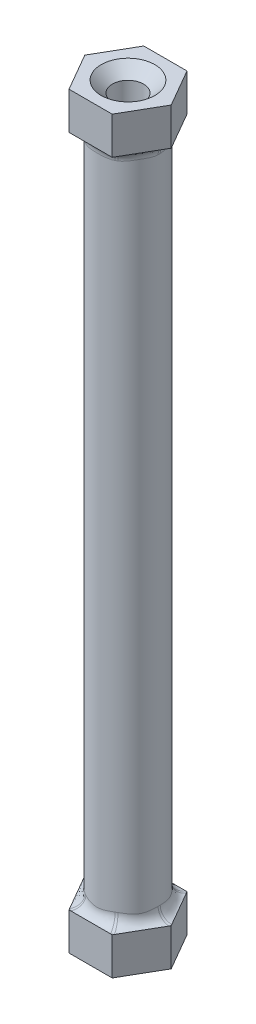
from build123d import *

# Parameters (mm, degrees)
EXTRUDE_1_DEPTH        = 3
SKETCH_2_R             = 2.5
EXTRUDE_2_DEPTH        = 54
EXTRUDE_3_DEPTH        = 3
FILLET_1_R             = 0.9
HOLE_WIZARD_M3_1_D     = 2.5
HOLE_WIZARD_M3_1_DEPTH = 9.5
HOLE_WIZARD_M3_1_TIP   = 0.751075774
HOLE_WIZARD_M3_2_D     = 2.5
HOLE_WIZARD_M3_2_DEPTH = 9.5
HOLE_WIZARD_M3_2_TIP   = 0.751075774
CHAMFER_1_SIZE         = 0.9


with BuildPart() as part:
    # 草图1 → 凸台-拉伸1 (new body)
    with BuildSketch(Plane(origin=(0, 0, 0), x_dir=(1, 0, 0), z_dir=(0, 1, 0))):
        Polygon((1.732050808, -3), (3.464101615, 0), (1.732050808, 3), (-1.732050808, 3), (-3.464101615, 0), (-1.732050808, -3), align=None)
    extrude(amount=EXTRUDE_1_DEPTH)

    # 草图2 → 凸台-拉伸2 (add)
    with BuildSketch(Plane(origin=(0, 3, 0), x_dir=(1, 0, 0), z_dir=(0, 1, 0))):
        with Locations(Location((0, 0, 0), (0, 0, 270))):
            Circle(SKETCH_2_R)
    extrude(amount=EXTRUDE_2_DEPTH)

    # 草图3 → 凸台-拉伸3 (add)
    with BuildSketch(Plane(origin=(0, 57, 0), x_dir=(1, 0, 0), z_dir=(0, 1, 0))):
        Polygon((-1.732050808, -3), (1.732050808, -3), (3.464101615, 0), (1.732050808, 3), (-1.732050808, 3), (-3.464101615, 0), align=None)
    extrude(amount=EXTRUDE_3_DEPTH)

    # 圆角1
    fillet_1_edges = [part.edges().sort_by_distance(p)[0] for p in [
        (0, 3, -2.5),
        (0, 57, -2.5),
    ]]
    fillet(fillet_1_edges, radius=FILLET_1_R)

    # M3 螺纹孔1
    with Locations(Plane(origin=(0, 60, 0), x_dir=(1, 0, 0), z_dir=(0, 1, 0))):
        with Locations((0, 0)):
            Hole(HOLE_WIZARD_M3_1_D / 2, depth=HOLE_WIZARD_M3_1_DEPTH)
            with Locations((0, 0, -(HOLE_WIZARD_M3_1_DEPTH + HOLE_WIZARD_M3_1_TIP / 2))):  # 118° drill point
                Cone(0, HOLE_WIZARD_M3_1_D / 2, HOLE_WIZARD_M3_1_TIP, mode=Mode.SUBTRACT)

    # M3 螺纹孔2
    with Locations(Plane(origin=(0, 0, 0), x_dir=(-1, 0, 0), z_dir=(0, -1, 0))):
        with Locations((0, 0)):
            Hole(HOLE_WIZARD_M3_2_D / 2, depth=HOLE_WIZARD_M3_2_DEPTH)
            with Locations((0, 0, -(HOLE_WIZARD_M3_2_DEPTH + HOLE_WIZARD_M3_2_TIP / 2))):  # 118° drill point
                Cone(0, HOLE_WIZARD_M3_2_D / 2, HOLE_WIZARD_M3_2_TIP, mode=Mode.SUBTRACT)

    # 倒角1
    chamfer_1_edges = [part.edges().sort_by_distance(p)[0] for p in [
        (1.25, 60, 0),
        (-1.25, 0, 0),
    ]]
    chamfer(chamfer_1_edges, length=CHAMFER_1_SIZE)


solid = part.part
